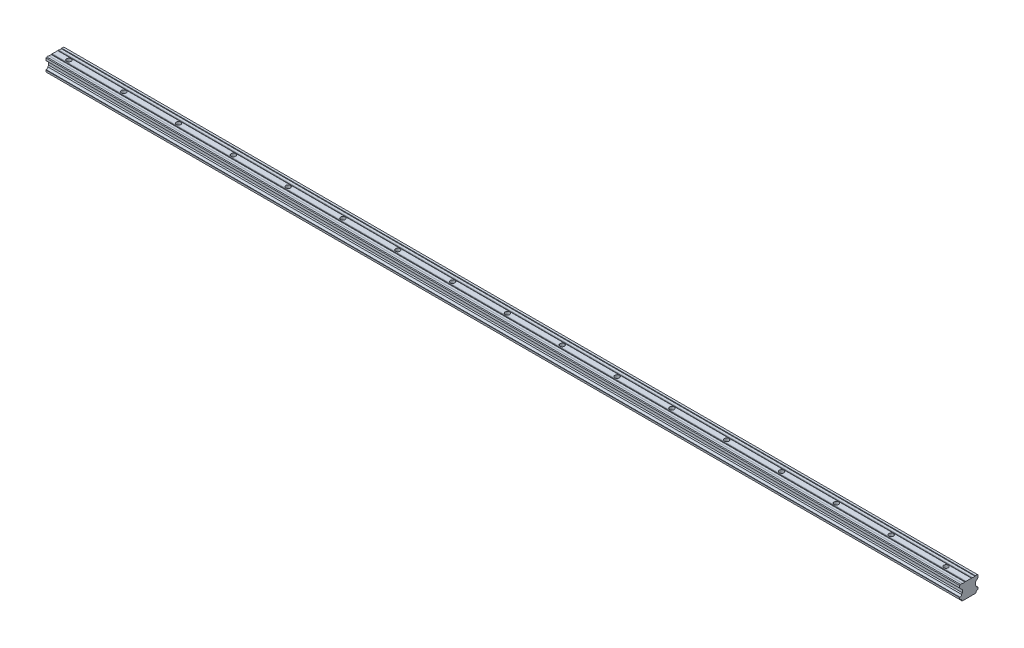
from build123d import *

# Parameters (mm, degrees)
BOSS_EXTRUDE1_DEPTH   = 1000
CROQUIS1_R            = 2.5
CORTAR_EXTRUIR1_DEPTH = 1001.190882073
MATRIZL1_COUNT        = 17
MATRIZL1_PITCH        = 60


with BuildPart() as part:
    # Sketch1 → Boss-Extrude1 (new body)
    with BuildSketch(Plane(origin=(0, 0, 0), x_dir=(0, 0, -1), z_dir=(1, 0, 0))):
        with BuildLine():
            Line((-7.965754986, -7.693975449), (-7.266272068, -8.393458366))
            Line((-7.266272068, -8.393458366), (7.266272068, -8.393458366))
            Line((7.266272068, -8.393458366), (7.965754986, -7.693975449))
            ThreePointArc((7.965754986, -7.693975449), (8.474723757, -6.421557866), (9.747437917, -5.913331162))
            Line((9.747437917, -5.913331162), (10.000000437, -5.660768637))
            Line((10.000000437, -5.660768637), (10.000000437, -3.788406023))
            Line((10.000000437, -3.788406023), (9.747437912, -3.535843503))
            ThreePointArc((9.747437912, -3.535843503), (8.462742055, -3.016656911), (7.965755402, -1.72321096))
            Line((7.965755402, -1.72321096), (7.005148341, -0.762603918))
            Line((7.005148341, -0.762603918), (7.005148341, 2.166206023))
            Line((7.005148341, 2.166206023), (10.000000347, 5.161058089))
            Line((10.000000347, 5.161058089), (10.000000347, 7.712387211))
            Line((10.000000347, 7.712387211), (9.408464779, 8.393458268))
            Line((9.408464779, 8.393458268), (7.133016457, 8.393458268))
            Line((7.133016457, 8.393458268), (6.789534443, 8.049976247))
            Line((6.789534443, 8.049976247), (4.271139656, 8.049976247))
            Line((4.271139656, 8.049976247), (3.927707784, 8.393458265))
            Line((3.927707784, 8.393458265), (3.061282509, 8.393458265))
            Line((3.061282509, 8.393458265), (2.872049327, 8.204225079))
            Line((2.872049327, 8.204225079), (-2.87204886, 8.204225079))
            Line((-2.87204886, 8.204225079), (-3.061282046, 8.393458261))
            Line((-3.061282046, 8.393458261), (-3.927707321, 8.393458261))
            Line((-3.927707321, 8.393458261), (-4.271189216, 8.049976359))
            Line((-4.271189216, 8.049976359), (-6.789534095, 8.049976359))
            Line((-6.789534095, 8.049976359), (-7.133016116, 8.393458373))
            Line((-7.133016116, 8.393458373), (-9.30771733, 8.393458373))
            Line((-9.30771733, 8.393458373), (-10, 7.70117569))
            Line((-10, 7.70117569), (-10, 5.161058187))
            Line((-10, 5.161058187), (-7.005147934, 2.166206181))
            Line((-7.005147934, 2.166206181), (-7.005147934, -0.76260376))
            Line((-7.005147934, -0.76260376), (-7.965754986, -1.723210812))
            ThreePointArc((-7.965754986, -1.723210812), (-8.462741848, -3.016656549), (-9.747437477, -3.535843372))
            Line((-9.747437477, -3.535843372), (-10, -3.788405895))
            Line((-10, -3.788405895), (-10, -5.660768509))
            Line((-10, -5.660768509), (-9.747437477, -5.913331032))
            ThreePointArc((-9.747437477, -5.913331032), (-8.474723558, -6.421557943), (-7.965754986, -7.693975449))
        make_face()
    extrude(amount=BOSS_EXTRUDE1_DEPTH)

    # Croquis1 → Cortar-Extruir1 (cut, through all)
    with BuildSketch(Plane(origin=(0, -8.393458366, 0), x_dir=(-1, 0, 0), z_dir=(0, -1, 0))):
        with Locations(Location((-15, 0, 0), (0, 0, 90))):
            Circle(CROQUIS1_R)
    cortar_extruir1 = extrude(amount=-CORTAR_EXTRUIR1_DEPTH, mode=Mode.SUBTRACT)

    # MatrizL1: Cortar-Extruir1 ×17
    with Locations(*[(i * MATRIZL1_PITCH, 0, 0) for i in range(1, MATRIZL1_COUNT)]):
        add(cortar_extruir1, mode=Mode.SUBTRACT)


solid = part.part
